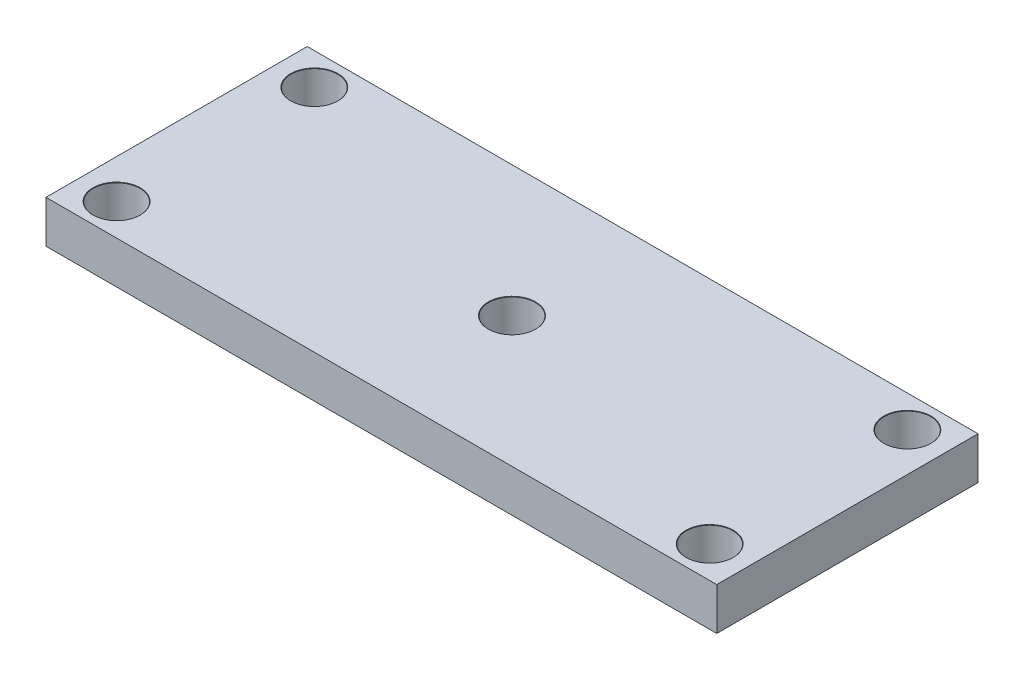
from build123d import *

# Parameters (mm, degrees)
SKETCH1_W                            = 47.5
SKETCH1_H                            = 18.5
BOSS_EXTRUDE1_DEPTH                  = 3
F_3_3_3_3_DIAMETER_HOLE1_D           = 3.3
F_3_3_3_3_DIAMETER_HOLE1_CSINK_D     = 3.35
F_3_3_3_3_DIAMETER_HOLE1_CSINK_ANGLE = 90


with BuildPart() as part:
    # Sketch1 → Boss-Extrude1 (new body)
    with BuildSketch(Plane(origin=(0, 0, 0), x_dir=(1, 0, 0), z_dir=(0, 1, 0))):
        Rectangle(SKETCH1_W, SKETCH1_H)
    extrude(amount=BOSS_EXTRUDE1_DEPTH)

    # Ø3.3 (3.3) Diameter Hole1 (through all)
    with Locations(Plane(origin=(0, 3, 0), x_dir=(1, 0, 0), z_dir=(0, 1, 0))):
        with Locations((0, 0), (21, -7), (-21, 7), (-21, -7), (21, 7)):
            CounterSinkHole(F_3_3_3_3_DIAMETER_HOLE1_D / 2, F_3_3_3_3_DIAMETER_HOLE1_CSINK_D / 2, counter_sink_angle=F_3_3_3_3_DIAMETER_HOLE1_CSINK_ANGLE)


solid = part.part
